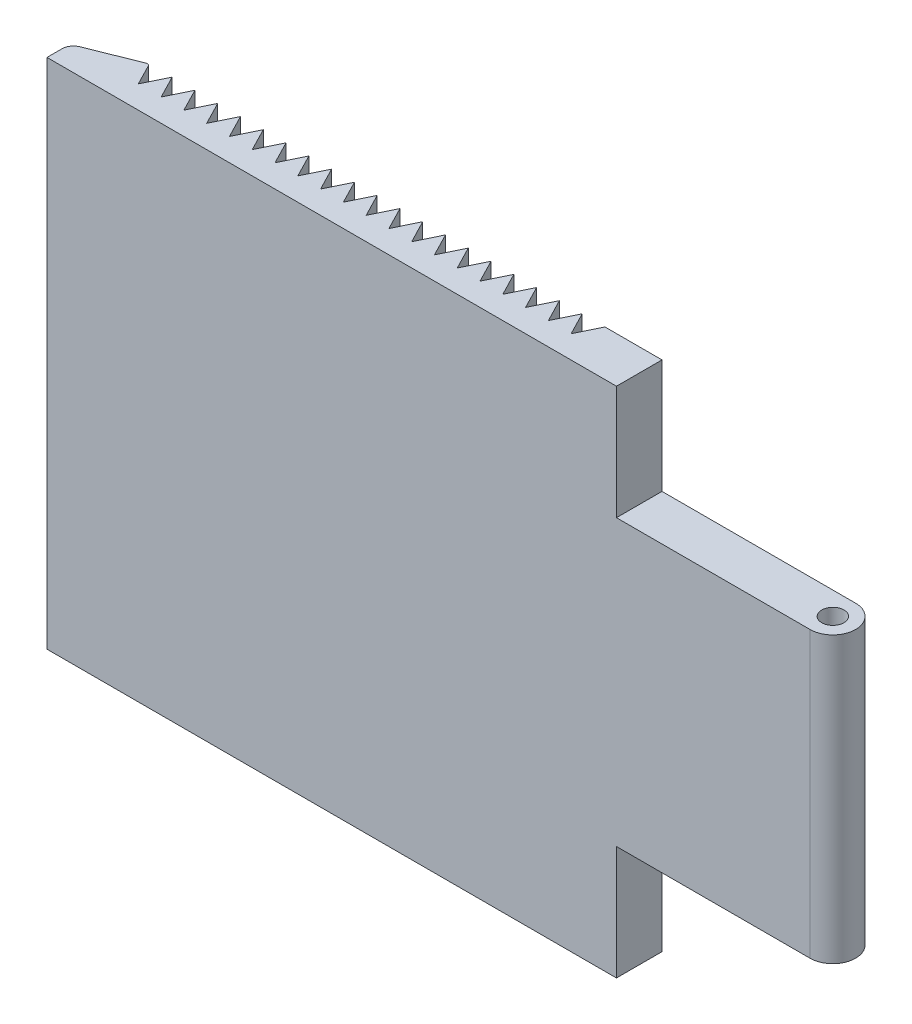
from build123d import *

# Parameters (mm, degrees)
BOSS_EXTRUDE1_DEPTH = 8
SKETCH2_R           = 1.95
CUT_EXTRUDE1_DEPTH  = 150
CUT_EXTRUDE2_DEPTH  = 150
CUT_EXTRUDE3_DEPTH  = 150
FILLET2_R           = 0.5
FILLET3_R           = 2


with BuildPart() as part:
    # Sketch1 → Boss-Extrude1 (new body)
    with BuildSketch(Plane.XY):
        Polygon((50, 45), (-50, 45), (-50, -45), (50, -45), (50, -25), (90, -25), (90, 25), (50, 25), align=None)
    extrude(amount=BOSS_EXTRUDE1_DEPTH)

    # Sketch2 → Cut-Extrude1 (cut)
    with BuildSketch(Plane(origin=(0, 25, 0), x_dir=(1, 0, 0), z_dir=(0, 1, 0))):
        with Locations(Location((84, -4, 0), (0, 0, 180))):
            Circle(SKETCH2_R)
    extrude(amount=-CUT_EXTRUDE1_DEPTH, mode=Mode.SUBTRACT)

    # Sketch3 → Cut-Extrude2 (cut)
    with BuildSketch(Plane(origin=(0, 25, 0), x_dir=(1, 0, 0), z_dir=(0, 1, 0))):
        with BuildLine():
            Line((90, -8), (84, -8))
            ThreePointArc((84, -8), (88, -4), (84, 0))
            Line((84, 0), (90, 0))
            Line((90, 0), (90, -8))
        make_face()
    extrude(amount=-CUT_EXTRUDE2_DEPTH, mode=Mode.SUBTRACT)

    # Sketch4 → Cut-Extrude3 (cut)
    with BuildSketch(Plane(origin=(0, 45, 0), x_dir=(1, 0, 0), z_dir=(0, 1, 0))):
        Polygon((-50, -4), (-40.018576331, 0), (-37.957023518, -4), (-36.018576331, 0), (-33.957023518, -4), (-32.018576331, 0), (-29.957023518, -4), (-28.018576331, 0), (-25.957023518, -4), (-24.018576331, 0), (-21.957023518, -4), (-20.018576331, 0), (-17.957023518, -4), (-16.018576331, 0), (-13.957023518, -4), (-12.018576331, 0), (-9.957023518, -4), (-8.018576331, 0), (-5.957023518, -4), (-4.018576331, 0), (-1.957023518, -4), (-0.018576331, 0), (2.042976482, -4), (3.981423669, 0), (6.042976482, -4), (7.981423669, 0), (10.042976482, -4), (11.981423669, 0), (14.042976482, -4), (15.981423669, 0), (18.042976482, -4), (19.981423669, 0), (22.042976482, -4), (23.981423669, 0), (26.042976482, -4), (27.981423669, 0), (30.042976482, -4), (31.981423669, 0), (34.042976482, -4), (35.981423669, 0), (38.042976482, -4), (39.981423669, 0), (37.159266961, 4.620546543), (-31.267866038, 8.187837837), (-50, 0), align=None)
    extrude(amount=-CUT_EXTRUDE3_DEPTH, mode=Mode.SUBTRACT)

    # Fillet2
    fillet2_edges = [part.edges().sort_by_distance(p)[0] for p in [
        (-40.018576331, 0, 0),
    ]]
    fillet(fillet2_edges, radius=FILLET2_R)

    # Fillet3
    fillet3_edges = [part.edges().sort_by_distance(p)[0] for p in [
        (-50, 0, 4),
    ]]
    fillet(fillet3_edges, radius=FILLET3_R)


solid = part.part
